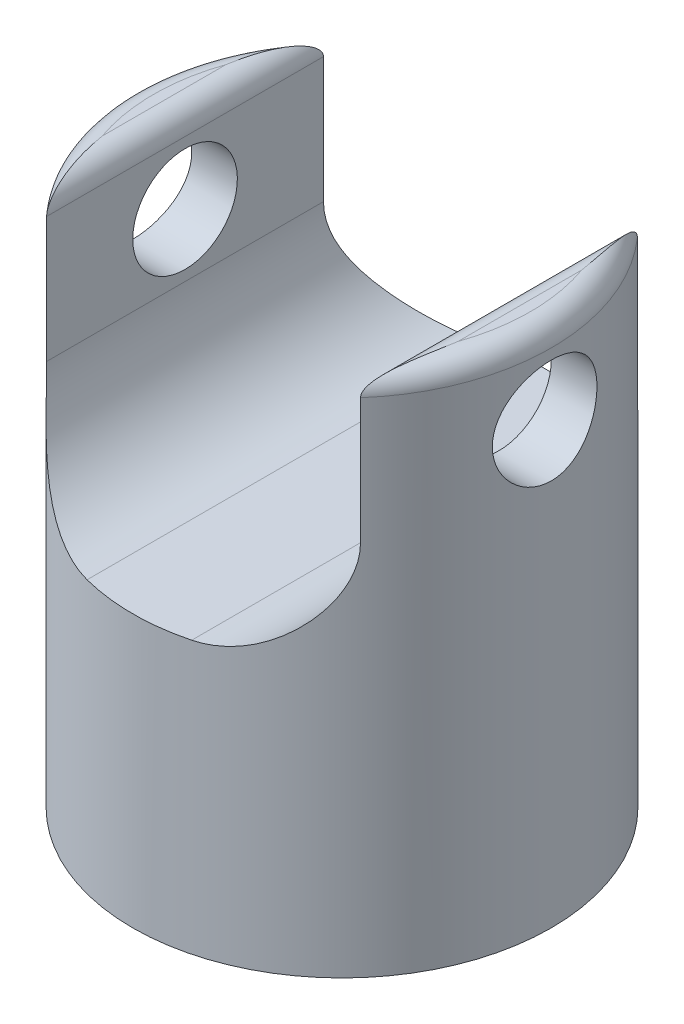
from build123d import *

# Parameters (mm, degrees)
CROQUIS1_W                 = 2
CROQUIS1_H                 = 5
CROQUIS2_W                 = 3
CROQUIS2_H                 = 4
CORTAR_EXTRUIR1_DEPTH      = 2.4
CORTAR_EXTRUIR2_DEPTH      = 2.4
REDONDEO1_R                = 0.2
REDONDEO2_R                = 1
CORTAR_EXTRUIR3_DEPTH      = 4.4
CORTAR_EXTRUIR3_DEPTH_BACK = 2.4
CROQUIS4_R                 = 0.5
CROQUIS5_R                 = 0.47625
CORTAR_EXTRUIR4_DEPTH      = 2.5


with BuildPart() as part:
    # Croquis1 → Revolución1 (revolve)
    with BuildSketch(Plane.XY):
        with Locations((-1.08056872, -1.940758294)):
            Rectangle(CROQUIS1_W, CROQUIS1_H)
    revolve(axis=Axis((-0.08056872, 0.559241706, 0), (0, -1, 0)))

    # Croquis2 → Cortar-Extruir1 (cut)
    with BuildSketch(Plane(origin=(0, 0.559241706, 0), x_dir=(1, 0, 0), z_dir=(0, 1, 0))):
        with Locations((-0.08056872, 0)):
            Rectangle(CROQUIS2_W, CROQUIS2_H)
    extrude(amount=-CORTAR_EXTRUIR1_DEPTH, mode=Mode.SUBTRACT)

    # Croquis3 → Cortar-Extruir2 (cut)
    with BuildSketch(Plane.XZ.offset(4.440758294)):
        with BuildLine():
            Line((-1.198602709, -1), (1.037465268, -1))
            ThreePointArc((1.037465268, -1), (-0.08056872, 1.5), (-1.198602709, -1))
        make_face()
    extrude(amount=-CORTAR_EXTRUIR2_DEPTH, mode=Mode.SUBTRACT)

    # Redondeo1
    redondeo1_edges = [part.edges().sort_by_distance(p)[0] for p in [
        (-1.951397414, 0.559241706, -0.707106781),
        (-1.58056872, 0.559241706, 0),
        (1.41943128, 0.559241706, 0),
        (1.91943128, 0.559241706, 0),
    ]]
    fillet(redondeo1_edges, radius=REDONDEO1_R)

    # Redondeo2
    redondeo2_edges = [part.edges().sort_by_distance(p)[0] for p in [
        (1.41943128, -1.840758294, 0),
        (-1.58056872, -1.840758294, 0),
    ]]
    fillet(redondeo2_edges, radius=REDONDEO2_R)

    # Croquis4 → Cortar-Extruir3 (cut, two sides: drawn at the far end of the back side and taken through both)
    with BuildSketch(Plane.ZY.offset(-1.41943128).offset(-CORTAR_EXTRUIR3_DEPTH_BACK)):
        with Locations((0, -0.240758294)):
            Circle(CROQUIS4_R)
    extrude(amount=CORTAR_EXTRUIR3_DEPTH + CORTAR_EXTRUIR3_DEPTH_BACK, mode=Mode.SUBTRACT)

    # Croquis5 → Cortar-Extruir4 (cut)
    with BuildSketch(Plane.XY.offset(-1)):
        with Locations((-0.082534732, -3.240758294)):
            Circle(CROQUIS5_R)
    extrude(amount=-CORTAR_EXTRUIR4_DEPTH, mode=Mode.SUBTRACT)


solid = part.part
